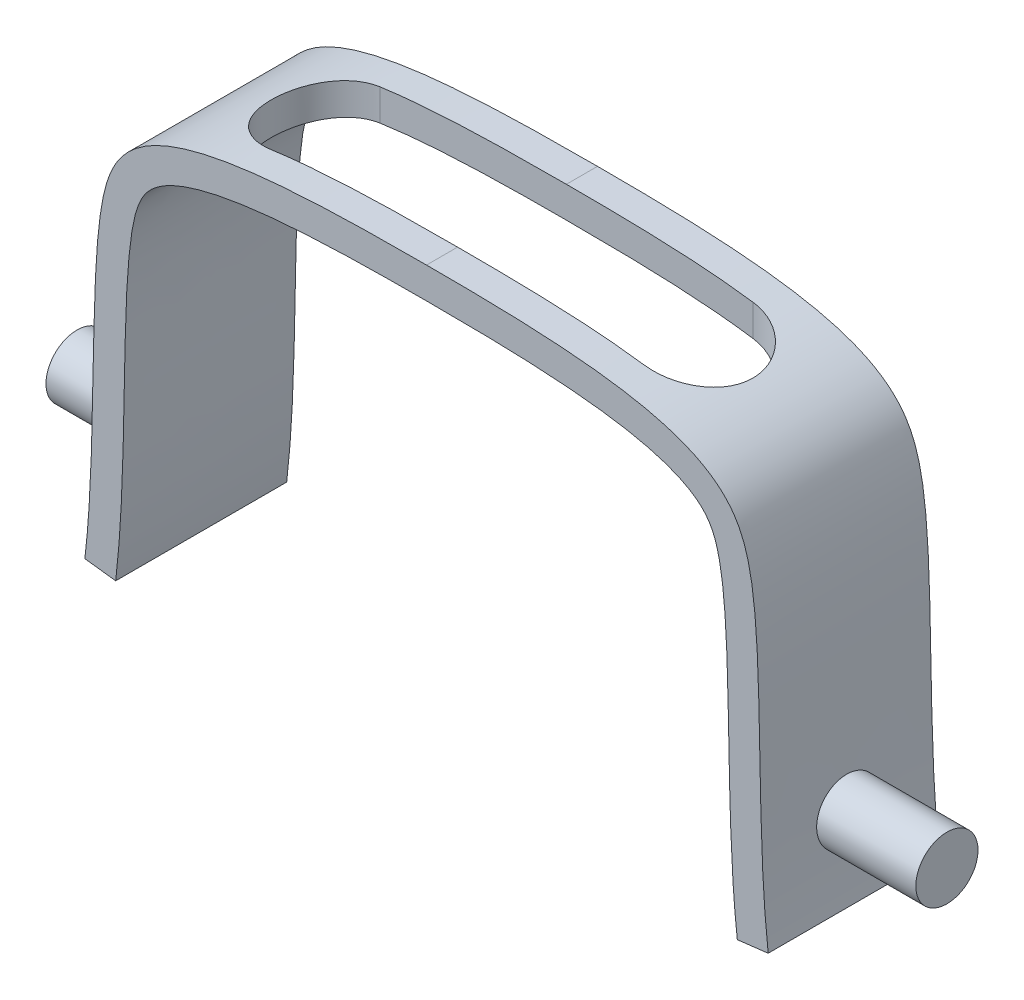
from build123d import *

# Parameters (mm, degrees)
MAIN_BODY_DEPTH              = 6.985
SLOT_FOR_JOYSTICK_DEPTH      = 127
SLOT_FOR_JOYSTICK_DEPTH_BACK = 127
SKETCH5_R                    = 2.54
NIBBLE_TWO_DEPTH             = 7.62
NIBBLE_TWO_DIRECTION_2_REACH = 68.564
SKETCH6_R                    = 2.54
NIBBLE_ONE_DEPTH             = 7.62
NIBBLE_ONE_DIRECTION_2_REACH = 75.073
SKETCH7_W                    = 3.81
SKETCH7_H                    = 1.27
FLAG_DEPTH                   = 0.254


with BuildPart() as part:
    # Sketch3 → main body (new, symmetric)
    with BuildSketch(Plane.XY):
        with BuildLine():
            Line((-27.916910697, 0.818098475), (-25.394720856, 0.517834583))
            add(Edge.make_bspline(
                [(-25.394720856, 0.517834583), (-24.289659103, 9.800254467), (-25.309171876, 25.144064865), (-21.103330705, 32.672370394), (-9.259543282, 33.02), (0, 33.02)],
                knots=[0, 0, 0, 0, 0.433889372, 0.533889372, 1, 1, 1, 1], degree=3))
            add(Edge.make_bspline(
                [(25.394720856, 0.517834583), (24.289659103, 9.800254467), (25.309171876, 25.144064865), (21.103330705, 32.672370394), (9.259543282, 33.02), (0, 33.02)],
                knots=[0, 0, 0, 0, 0.433889372, 0.533889372, 1, 1, 1, 1], degree=3))
            Line((25.394720856, 0.517834583), (27.916910697, 0.818098475))
            add(Edge.make_bspline(
                [(0, 35.56), (2.504792284, 35.56), (7.588261473, 35.51847444), (13.569218674, 35.128973367), (17.789687075, 34.446912983), (20.620387258, 33.684944292), (22.68572116, 32.742807522), (24.136863213, 31.661814521), (25.084575313, 30.615010717), (25.778197543, 29.383403628), (26.226017768, 28.084316609), (26.532207717, 26.69442114), (26.828081049, 24.65843792), (27.046560459, 21.762703474), (27.176330929, 17.812577908), (27.251426867, 13.549272517), (27.346875323, 9.149553118), (27.501921862, 5.540111523), (27.707850026, 2.767103544), (27.838779979, 1.474389517), (27.916910697, 0.818098475)],
                knots=[0, 0, 0, 0, 0.125, 0.25, 0.3125, 0.375, 0.4375, 0.46875, 0.5, 0.53125, 0.5625, 0.59375, 0.625, 0.6875, 0.75, 0.8125, 0.875, 0.9375, 0.96875, 1, 1, 1, 1], degree=3))
            add(Edge.make_bspline(
                [(-27.916910697, 0.818098475), (-27.838779979, 1.474389517), (-27.707850026, 2.767103544), (-27.501921862, 5.540111523), (-27.346875323, 9.149553118), (-27.251426867, 13.549272517), (-27.176330929, 17.812577908), (-27.046560459, 21.762703474), (-26.828081049, 24.65843792), (-26.532207717, 26.69442114), (-26.226017768, 28.084316609), (-25.778197543, 29.383403628), (-25.084575313, 30.615010717), (-24.136863213, 31.661814521), (-22.68572116, 32.742807522), (-20.620387258, 33.684944292), (-17.789687075, 34.446912983), (-13.569218674, 35.128973367), (-7.588261473, 35.51847444), (-2.504792284, 35.56), (0, 35.56)],
                knots=[0, 0, 0, 0, 0.03125, 0.0625, 0.125, 0.1875, 0.25, 0.3125, 0.375, 0.40625, 0.4375, 0.46875, 0.5, 0.53125, 0.5625, 0.625, 0.6875, 0.75, 0.875, 1, 1, 1, 1], degree=3))
        make_face()
    extrude(amount=MAIN_BODY_DEPTH, both=True)

    # Sketch4 → slot for joystick (cut, two sides: drawn at the far end of the back side and taken through both)
    with BuildSketch(Plane(origin=(0, 35.56, 0), x_dir=(1, 0, 0), z_dir=(0, 1, 0)).offset(-SLOT_FOR_JOYSTICK_DEPTH_BACK)):
        with BuildLine():
            Line((-15.24, 4.445), (15.24, 4.445))
            ThreePointArc((15.24, 4.445), (19.685, 0), (15.24, -4.445))
            Line((15.24, -4.445), (-15.24, -4.445))
            ThreePointArc((-15.24, -4.445), (-19.685, 0), (-15.24, 4.445))
        make_face()
    extrude(amount=SLOT_FOR_JOYSTICK_DEPTH + SLOT_FOR_JOYSTICK_DEPTH_BACK, mode=Mode.SUBTRACT)

    # Sketch5 → nibble two (add)
    with BuildSketch(Plane(origin=(27.916910697, 0, 0), x_dir=(0, 0, -1), z_dir=(1, 0, 0))):
        with Locations((0, 7.168098475)):
            Circle(SKETCH5_R)
    extrude(amount=NIBBLE_TWO_DEPTH)

    # Sketch5 → nibble two direction 2 (add, up to next)
    with BuildSketch(Plane(origin=(27.916910697, 0, 0), x_dir=(0, 0, -1), z_dir=(1, 0, 0)), mode=Mode.PRIVATE) as nibble_two_direction_2_sk1:
        with Locations((0, 7.168098475)):
            Circle(SKETCH5_R)
    nibble_two_direction_2_tool1 = extrude(nibble_two_direction_2_sk1.sketch, amount=-NIBBLE_TWO_DIRECTION_2_REACH, mode=Mode.PRIVATE) - part.part
    add(nibble_two_direction_2_tool1.solids().sort_by_distance((27.916911, 7.168098, 0))[0])

    # Sketch6 → nibble one (add)
    with BuildSketch(Plane(origin=(-27.916910697, 0, 0), x_dir=(0, 0, -1), z_dir=(1, 0, 0))):
        with Locations((0, 7.168098475)):
            Circle(SKETCH6_R)
    extrude(amount=-NIBBLE_ONE_DEPTH)

    # Sketch6 → nibble one direction 2 (add, up to next)
    with BuildSketch(Plane(origin=(-27.916910697, 0, 0), x_dir=(0, 0, -1), z_dir=(1, 0, 0)), mode=Mode.PRIVATE) as nibble_one_direction_2_sk1:
        with Locations((0, 7.168098475)):
            Circle(SKETCH6_R)
    nibble_one_direction_2_tool1 = extrude(nibble_one_direction_2_sk1.sketch, amount=NIBBLE_ONE_DIRECTION_2_REACH, mode=Mode.PRIVATE) - part.part
    add(nibble_one_direction_2_tool1.solids().sort_by_distance((-27.916911, 7.168098, 0))[0])

    # Sketch7 → flag (add)
    with BuildSketch(Plane(origin=(0, 7.168098475, 0), x_dir=(1, 0, 0), z_dir=(0, 1, 0))):
        with Locations((-29.429266279, -0.015489835)):
            Rectangle(SKETCH7_W, SKETCH7_H)
    extrude(amount=-FLAG_DEPTH)


solid = part.part
